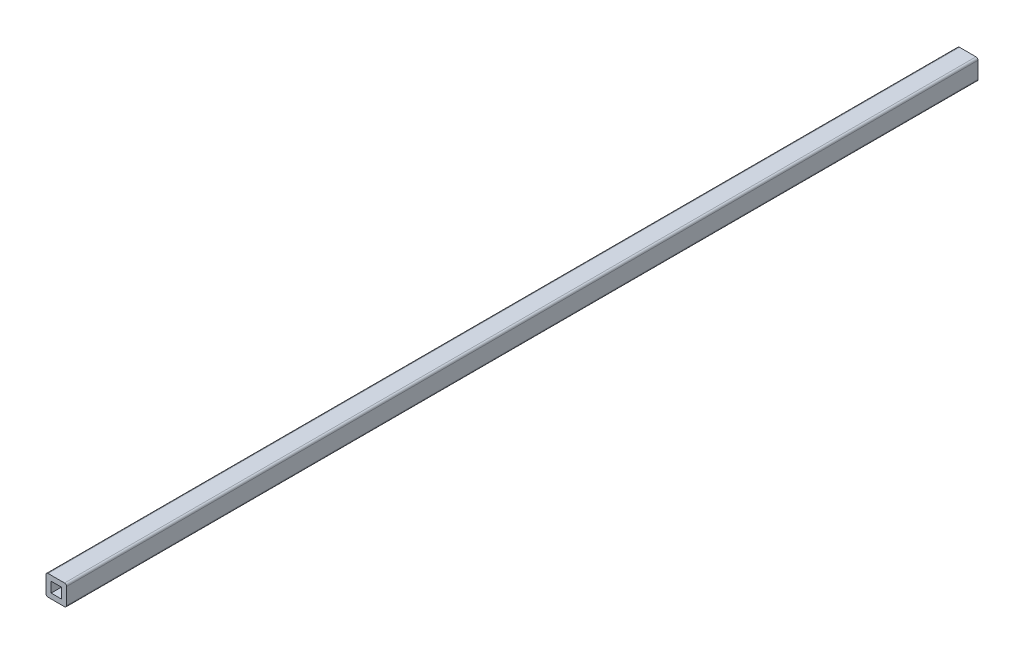
from build123d import *

# Parameters (mm, degrees)
SKETCH1_W           = 50.8
SKETCH1_H           = 50.8
SKETCH1_W_2         = 25.4
SKETCH1_H_2         = 25.4
BOSS_EXTRUDE1_DEPTH = 2250.44
FILLET1_R           = 5


with BuildPart() as part:
    # Sketch1 → Boss-Extrude1 (new body)
    with BuildSketch(Plane.XY):
        Rectangle(SKETCH1_W, SKETCH1_H)
        Rectangle(SKETCH1_W_2, SKETCH1_H_2, mode=Mode.SUBTRACT)
    extrude(amount=BOSS_EXTRUDE1_DEPTH)

    # Fillet1
    fillet1_edges = [part.edges().sort_by_distance(p)[0] for p in [
        (25.4, -25.4, 1125.22),
        (-25.4, -25.4, 1125.22),
        (-25.4, 25.4, 1125.22),
        (25.4, 25.4, 1125.22),
    ]]
    fillet(fillet1_edges, radius=FILLET1_R)


solid = part.part
